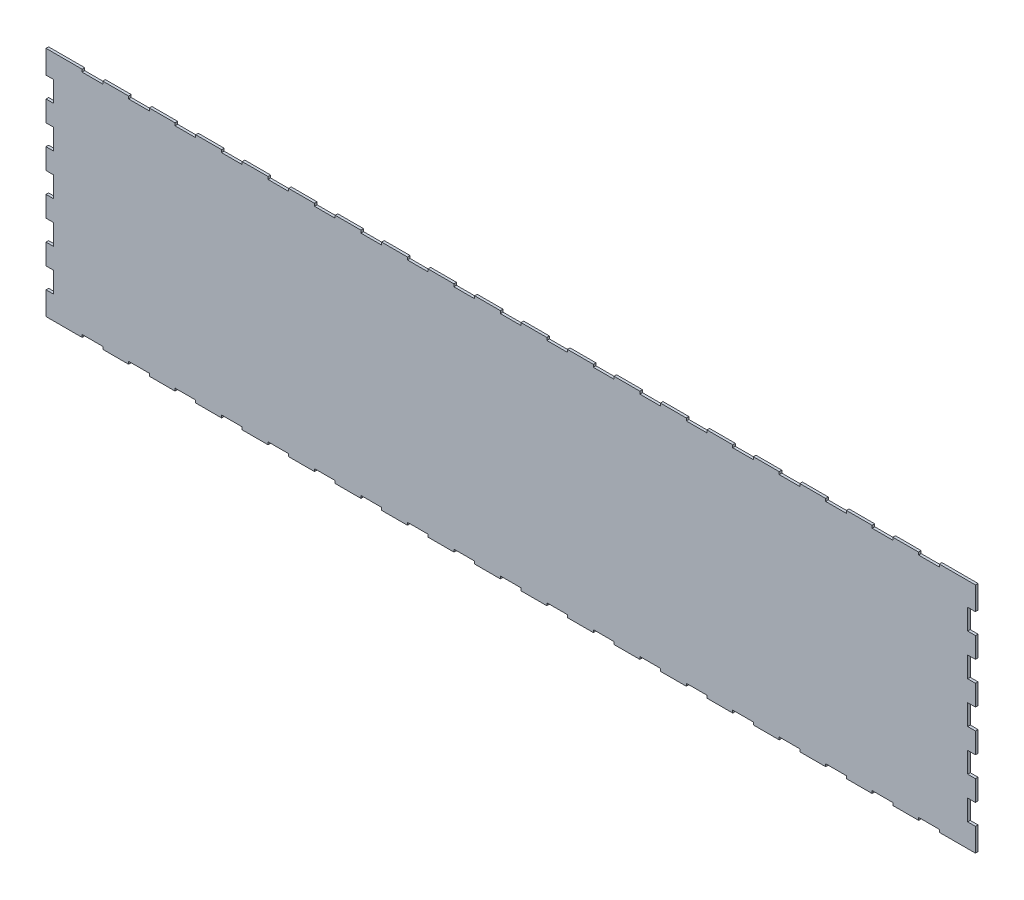
from build123d import *

# Parameters (mm, degrees)
BOSS_EXTRUDE1_DEPTH = 5


with BuildPart() as part:
    # Sketch1 → Boss-Extrude1 (new body)
    with BuildSketch(Plane.XY):
        Polygon((885, 100), (885, 60), (900, 60), (900, 20), (885, 20), (885, -20), (900, -20), (900, -60), (885, -60), (885, -100), (900, -100), (900, -140), (885, -140), (885, -180), (900, -180), (900, -225), (830, -225), (830, -220), (790, -220), (790, -225), (740, -225), (740, -220), (700, -220), (700, -225), (650, -225), (650, -220), (610, -220), (610, -225), (560, -225), (560, -220), (520, -220), (520, -225), (470, -225), (470, -220), (430, -220), (430, -225), (380, -225), (380, -220), (340, -220), (340, -225), (290, -225), (290, -220), (250, -220), (250, -225), (200, -225), (200, -220), (160, -220), (160, -225), (110, -225), (110, -220), (70, -220), (70, -225), (20, -225), (20, -220), (-20, -220), (-20, -225), (-70, -225), (-70, -220), (-110, -220), (-110, -225), (-160, -225), (-160, -220), (-200, -220), (-200, -225), (-250, -225), (-250, -220), (-290, -220), (-290, -225), (-340, -225), (-340, -220), (-380, -220), (-380, -225), (-430, -225), (-430, -220), (-470, -220), (-470, -225), (-520, -225), (-520, -220), (-560, -220), (-560, -225), (-610, -225), (-610, -220), (-650, -220), (-650, -225), (-700, -225), (-700, -220), (-740, -220), (-740, -225), (-790, -225), (-790, -220), (-830, -220), (-830, -225), (-900, -225), (-900, -180), (-885, -180), (-885, -140), (-900, -140), (-900, -100), (-885, -100), (-885, -60), (-900, -60), (-900, -20), (-885, -20), (-885, 20), (-900, 20), (-900, 60), (-885, 60), (-885, 100), (-900, 100), (-900, 140), (-885, 140), (-885, 180), (-900, 180), (-900, 225), (-830, 225), (-830, 220), (-790, 220), (-790, 225), (-740, 225), (-740, 220), (-700, 220), (-700, 225), (-650, 225), (-650, 220), (-610, 220), (-610, 225), (-560, 225), (-560, 220), (-520, 220), (-520, 225), (-470, 225), (-470, 220), (-430, 220), (-430, 225), (-380, 225), (-380, 220), (-340, 220), (-340, 225), (-290, 225), (-290, 220), (-250, 220), (-250, 225), (-200, 225), (-200, 220), (-160, 220), (-160, 225), (-110, 225), (-110, 220), (-70, 220), (-70, 225), (-20, 225), (-20, 220), (20, 220), (20, 225), (70, 225), (70, 220), (110, 220), (110, 225), (160, 225), (160, 220), (200, 220), (200, 225), (250, 225), (250, 220), (290, 220), (290, 225), (340, 225), (340, 220), (380, 220), (380, 225), (430, 225), (430, 220), (470, 220), (470, 225), (520, 225), (520, 220), (560, 220), (560, 225), (610, 225), (610, 220), (650, 220), (650, 225), (700, 225), (700, 220), (740, 220), (740, 225), (790, 225), (790, 220), (830, 220), (830, 225), (900, 225), (900, 180), (885, 180), (885, 140), (900, 140), (900, 100), align=None)
    extrude(amount=BOSS_EXTRUDE1_DEPTH)


solid = part.part
